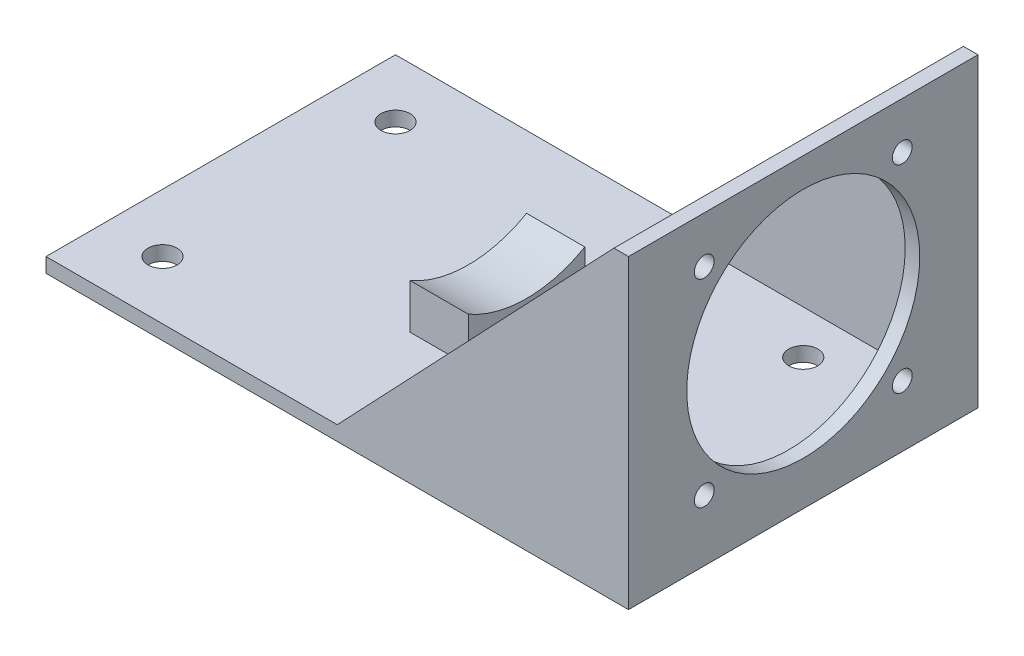
from build123d import *

# Parameters (mm, degrees)
SKETCH1_W           = 254
SKETCH1_H           = 152.4
BOSS_EXTRUDE1_DEPTH = 6.35
SKETCH2_W           = 152.4
SKETCH2_H           = 127
SKETCH2_R           = 50.8
SKETCH2_R_2         = 4.318
BOSS_EXTRUDE2_DEPTH = 6.35
BOSS_EXTRUDE3_DEPTH = 6.35
BOSS_EXTRUDE4_DEPTH = 6.35
SKETCH5_W           = 25.4
SKETCH5_H           = 50.8
BOSS_EXTRUDE5_DEPTH = 25.4
CUT_EXTRUDE1_START  = -25.4
SKETCH6_R           = 50.8
CUT_EXTRUDE1_DEPTH  = 25.4
SKETCH7_R           = 6.35
CUT_EXTRUDE2_DEPTH  = 25.4


with BuildPart() as part:
    # Sketch1 → Boss-Extrude1 (new body)
    with BuildSketch(Plane(origin=(0, 0, 0), x_dir=(1, 0, 0), z_dir=(0, 1, 0))):
        Rectangle(SKETCH1_W, SKETCH1_H)
    extrude(amount=BOSS_EXTRUDE1_DEPTH)

    # Sketch2 → Boss-Extrude2 (add)
    with BuildSketch(Plane(origin=(127, 0, 0), x_dir=(0, 0, -1), z_dir=(1, 0, 0))):
        with Locations((0, 69.85)):
            Rectangle(SKETCH2_W, SKETCH2_H)
        with Locations((0, 69.85)):
            Circle(SKETCH2_R, mode=Mode.SUBTRACT)
        with Locations((-43.18, 26.67)):
            Circle(SKETCH2_R_2, mode=Mode.SUBTRACT)
        with Locations((43.18, 26.67)):
            Circle(SKETCH2_R_2, mode=Mode.SUBTRACT)
        with Locations((43.18, 113.03)):
            Circle(SKETCH2_R_2, mode=Mode.SUBTRACT)
        with Locations((-43.18, 113.03)):
            Circle(SKETCH2_R_2, mode=Mode.SUBTRACT)
    extrude(amount=-BOSS_EXTRUDE2_DEPTH)

    # Sketch3 → Boss-Extrude3 (add)
    with BuildSketch(Plane.XY.offset(76.2)):
        Polygon((120.65, 133.35), (0, 6.35), (120.65, 6.35), align=None)
    extrude(amount=-BOSS_EXTRUDE3_DEPTH)

    # Sketch4 → Boss-Extrude4 (add)
    with BuildSketch(Plane(origin=(0, 0, -76.2), x_dir=(-1, 0, 0), z_dir=(0, 0, -1))):
        Polygon((-120.65, 133.35), (0, 6.35), (-120.65, 6.35), align=None)
    extrude(amount=-BOSS_EXTRUDE4_DEPTH)

    # Sketch5 → Boss-Extrude5 (add)
    with BuildSketch(Plane(origin=(0, 6.35, 0), x_dir=(1, 0, 0), z_dir=(0, 1, 0))):
        with Locations((-6.35, 0)):
            Rectangle(SKETCH5_W, SKETCH5_H)
    extrude(amount=BOSS_EXTRUDE5_DEPTH)

    # Sketch6 → Cut-Extrude1 (cut)
    with BuildSketch(Plane.ZY.offset(19.05).offset(CUT_EXTRUDE1_START)):
        with Locations(Location((0, 69.85, 0), (0, 0, 180))):
            Circle(SKETCH6_R)
    extrude(amount=CUT_EXTRUDE1_DEPTH, mode=Mode.SUBTRACT)

    # Sketch7 → Cut-Extrude2 (cut)
    with BuildSketch(Plane(origin=(0, 6.35, 0), x_dir=(1, 0, 0), z_dir=(0, 1, 0))):
        with Locations(Location((-101.6, 50.8, 0), (0, 0, 270))):
            Circle(SKETCH7_R)
        with Locations(Location((-101.6, -50.8, 0), (0, 0, 270))):
            Circle(SKETCH7_R)
        with Locations(Location((76.2, -50.8, 0), (0, 0, 270))):
            Circle(SKETCH7_R)
        with Locations(Location((76.2, 50.8, 0), (0, 0, 270))):
            Circle(SKETCH7_R)
    extrude(amount=-CUT_EXTRUDE2_DEPTH, mode=Mode.SUBTRACT)


solid = part.part
